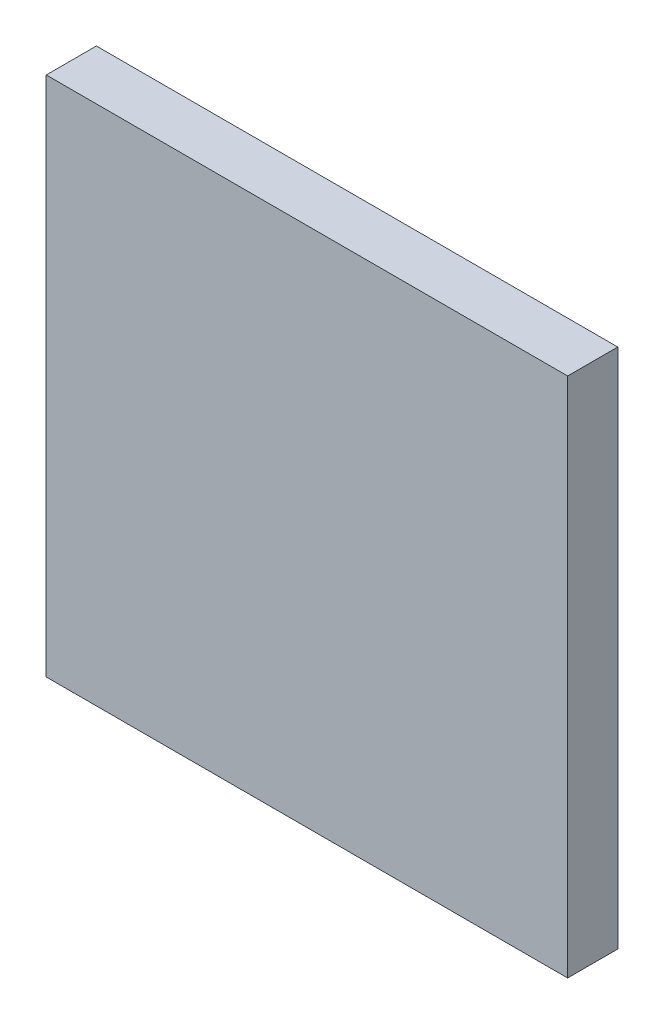
from build123d import *

# Parameters (mm, degrees)
ESQUISSE1_W        = 26
ESQUISSE1_H        = 26
BOSS_EXTRU_1_DEPTH = 1.25


with BuildPart() as part:
    # Esquisse1 → Boss.-Extru.1 (new, symmetric)
    with BuildSketch(Plane.XY):
        Rectangle(ESQUISSE1_W, ESQUISSE1_H)
    extrude(amount=BOSS_EXTRU_1_DEPTH, both=True)


solid = part.part
